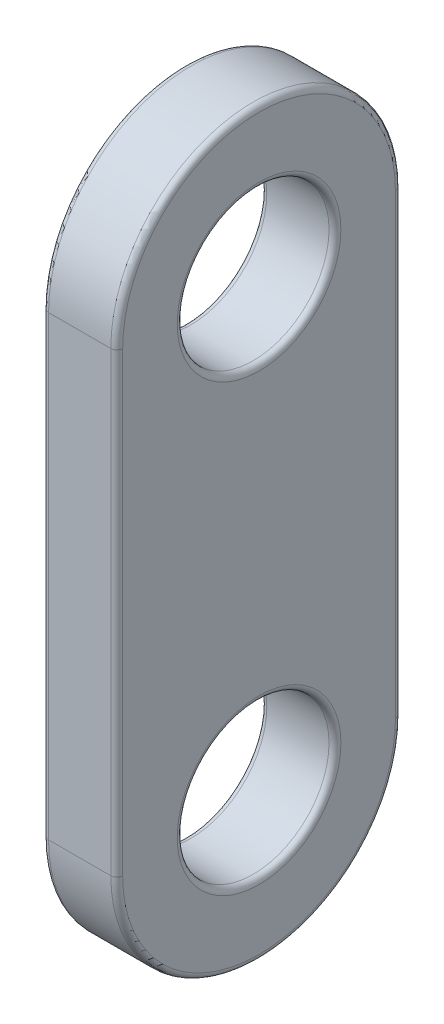
from build123d import *

# Parameters (mm, degrees)
SKETCH1_W           = 12.192
SKETCH1_H           = 31.75
SKETCH1_R           = 3.2512
BOSS_EXTRUDE1_DEPTH = 1.5875
FILLET1_RADIUS      = 6.096
FILLET1_LENGTH      = 3.175
FILLET2_RADIUS      = 6.096
FILLET2_LENGTH      = 3.175
FILLET3_R           = 0.254


with BuildPart() as part:
    # Sketch1 → Boss-Extrude1 (new, symmetric)
    with BuildSketch(Plane(origin=(0, 0, 0), x_dir=(0, 0, -1), z_dir=(1, 0, 0))):
        Rectangle(SKETCH1_W, SKETCH1_H)
        with Locations((0, 9.525)):
            Circle(SKETCH1_R, mode=Mode.SUBTRACT)
        with Locations((0, -9.525)):
            Circle(SKETCH1_R, mode=Mode.SUBTRACT)
    extrude(amount=BOSS_EXTRUDE1_DEPTH, both=True)

    # Fillet1: full round fillet: the end face becomes a half cylinder, R = half its width
    fillet1_face = Plane((0, 15.875, 0), x_dir=(1, 0, 0), z_dir=(0, 1, 0))  # on the end face: x along it, z out of the body
    fillet1_slab = fillet1_face.offset(-FILLET1_RADIUS / 2) * Box(FILLET1_LENGTH, 2 * FILLET1_RADIUS, FILLET1_RADIUS, mode=Mode.PRIVATE)  # the body's end, R deep
    fillet1_round = Plane((0, 9.779, 0), x_dir=(0, 1, 0), z_dir=(1, 0, 0)) * Cylinder(FILLET1_RADIUS, FILLET1_LENGTH, mode=Mode.PRIVATE)  # its axis R under the face
    add(fillet1_slab - fillet1_round, mode=Mode.SUBTRACT)

    # Fillet2: full round fillet: the end face becomes a half cylinder, R = half its width
    fillet2_face = Plane((0, -15.875, 0), x_dir=(1, 0, 0), z_dir=(0, -1, 0))  # on the end face: x along it, z out of the body
    fillet2_slab = fillet2_face.offset(-FILLET2_RADIUS / 2) * Box(FILLET2_LENGTH, 2 * FILLET2_RADIUS, FILLET2_RADIUS, mode=Mode.PRIVATE)  # the body's end, R deep
    fillet2_round = Plane((0, -9.779, 0), x_dir=(0, -1, 0), z_dir=(1, 0, 0)) * Cylinder(FILLET2_RADIUS, FILLET2_LENGTH, mode=Mode.PRIVATE)  # its axis R under the face
    add(fillet2_slab - fillet2_round, mode=Mode.SUBTRACT)

    # Fillet3
    fillet3_edges = [part.edges().sort_by_distance(p)[0] for p in [
        (-1.5875, 9.525, 3.2512),
        (1.5875, 9.525, 3.2512),
        (-1.5875, -9.525, 3.2512),
        (1.5875, -9.525, 3.2512),
        (-1.5875, 0, 6.096),
        (1.5875, 0, 6.096),
        (1.5875, 15.875, 0),
        (-1.5875, 15.875, 0),
        (-1.5875, 0, -6.096),
        (1.5875, 0, -6.096),
        (-1.5875, -15.875, 0),
        (1.5875, -15.875, 0),
    ]]
    fillet(fillet3_edges, radius=FILLET3_R)


solid = part.part
